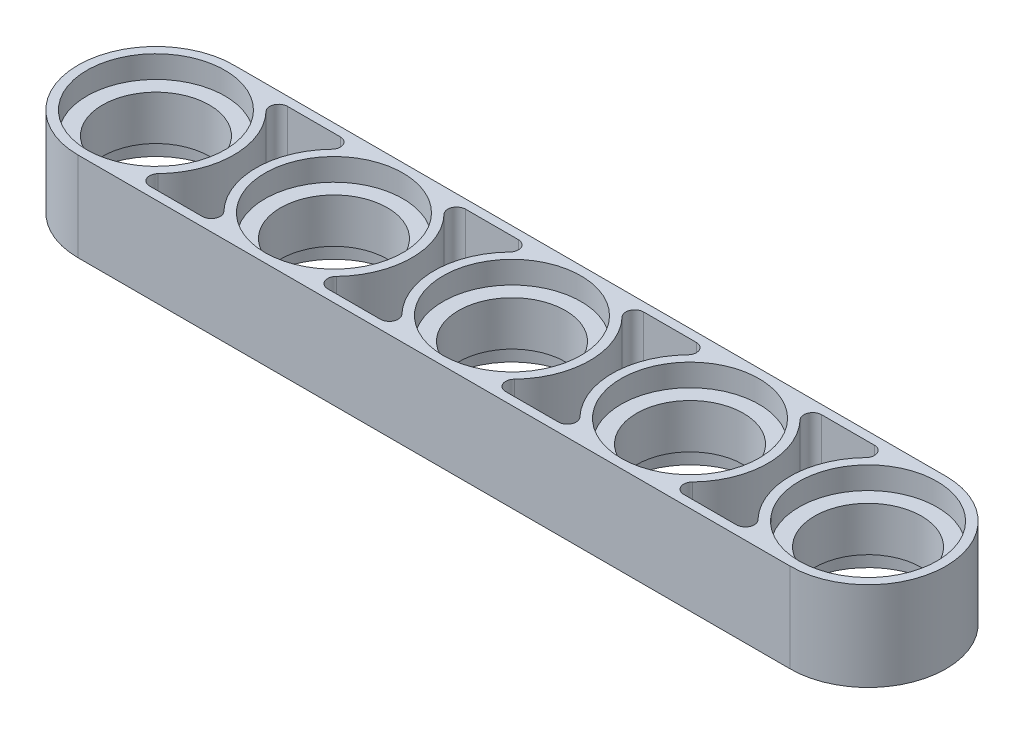
from build123d import *

# Parameters (mm, degrees)
BOSS_EXTRUDE1_DEPTH = 2
SKETCH3_R           = 3.1
CUT_EXTRUDE1_DEPTH  = 1
CUT_EXTRUDE2_START  = -1
SKETCH4_R           = 3.1
CUT_EXTRUDE2_DEPTH  = 1
SKETCH5_R           = 2.4
CUT_EXTRUDE3_DEPTH  = 36.895682192
LPATTERN2_COUNT     = 5
LPATTERN2_PITCH     = 8
CUT_EXTRUDE4_DEPTH  = 36.72814017
LPATTERN3_COUNT     = 4
LPATTERN3_PITCH     = 8


with BuildPart() as part:
    # Sketch2 → Boss-Extrude1 (new, symmetric)
    with BuildSketch(Plane(origin=(0, 0, 0), x_dir=(1, 0, 0), z_dir=(0, 1, 0))):
        with BuildLine():
            Line((0, 3.5), (32, 3.5))
            ThreePointArc((32, 3.5), (35.5, 0), (32, -3.5))
            Line((32, -3.5), (0, -3.5))
            ThreePointArc((0, -3.5), (-3.5, 0), (0, 3.5))
        make_face()
    extrude(amount=BOSS_EXTRUDE1_DEPTH, both=True)

    # Sketch3 → Cut-Extrude1 (cut)
    with BuildSketch(Plane(origin=(0, 2, 0), x_dir=(1, 0, 0), z_dir=(0, 1, 0))):
        with Locations(Location((0, 0, 0), (0, 0, 270))):
            Circle(SKETCH3_R)
    cut_extrude1 = extrude(amount=-CUT_EXTRUDE1_DEPTH, mode=Mode.SUBTRACT)

    # Sketch4 → Cut-Extrude2 (cut)
    with BuildSketch(Plane(origin=(0, -2, 0), x_dir=(-1, 0, 0), z_dir=(0, -1, 0)).offset(CUT_EXTRUDE2_START)):
        with Locations(Location((0, 0, 0), (0, 0, 270))):
            Circle(SKETCH4_R)
    cut_extrude2 = extrude(amount=CUT_EXTRUDE2_DEPTH, mode=Mode.SUBTRACT)

    # Sketch5 → Cut-Extrude3 (cut, through all)
    with BuildSketch(Plane(origin=(0, -2, 0), x_dir=(-1, 0, 0), z_dir=(0, -1, 0))):
        with Locations(Location((0, 0, 0), (0, 0, 90))):
            Circle(SKETCH5_R)
    cut_extrude3 = extrude(amount=-CUT_EXTRUDE3_DEPTH, mode=Mode.SUBTRACT)

    # LPattern2: Cut-Extrude1, Cut-Extrude2, Cut-Extrude3 ×5
    with Locations(*[(i * LPATTERN2_PITCH, 0, 0) for i in range(1, LPATTERN2_COUNT)]):
        add(cut_extrude1, mode=Mode.SUBTRACT)
        add(cut_extrude2, mode=Mode.SUBTRACT)
        add(cut_extrude3, mode=Mode.SUBTRACT)

    # Sketch6 → Cut-Extrude4 (cut, symmetric)
    with BuildSketch(Plane(origin=(0, 0, 0), x_dir=(1, 0, 0), z_dir=(0, 1, 0))):
        with BuildLine():
            Line((2.814249456, 3.1), (5.185750544, 3.1))
            ThreePointArc((5.185750544, 3.1), (5.553697029, 2.856892908), (5.474391514, 2.423076923))
            ThreePointArc((5.474391514, 2.423076923), (4.5, 0), (5.474391514, -2.423076923))
            ThreePointArc((5.474391514, -2.423076923), (5.553697029, -2.856892908), (5.185750544, -3.1))
            Line((5.185750544, -3.1), (2.814249456, -3.1))
            ThreePointArc((2.814249456, -3.1), (2.446302971, -2.856892908), (2.525608486, -2.423076923))
            ThreePointArc((2.525608486, -2.423076923), (3.5, 0), (2.525608486, 2.423076923))
            ThreePointArc((2.525608486, 2.423076923), (2.446302971, 2.856892908), (2.814249456, 3.1))
        make_face()
    cut_extrude4 = extrude(amount=CUT_EXTRUDE4_DEPTH, both=True, mode=Mode.SUBTRACT)

    # LPattern3: Cut-Extrude4 ×4
    with Locations(*[(i * LPATTERN3_PITCH, 0, 0) for i in range(1, LPATTERN3_COUNT)]):
        add(cut_extrude4, mode=Mode.SUBTRACT)


solid = part.part
